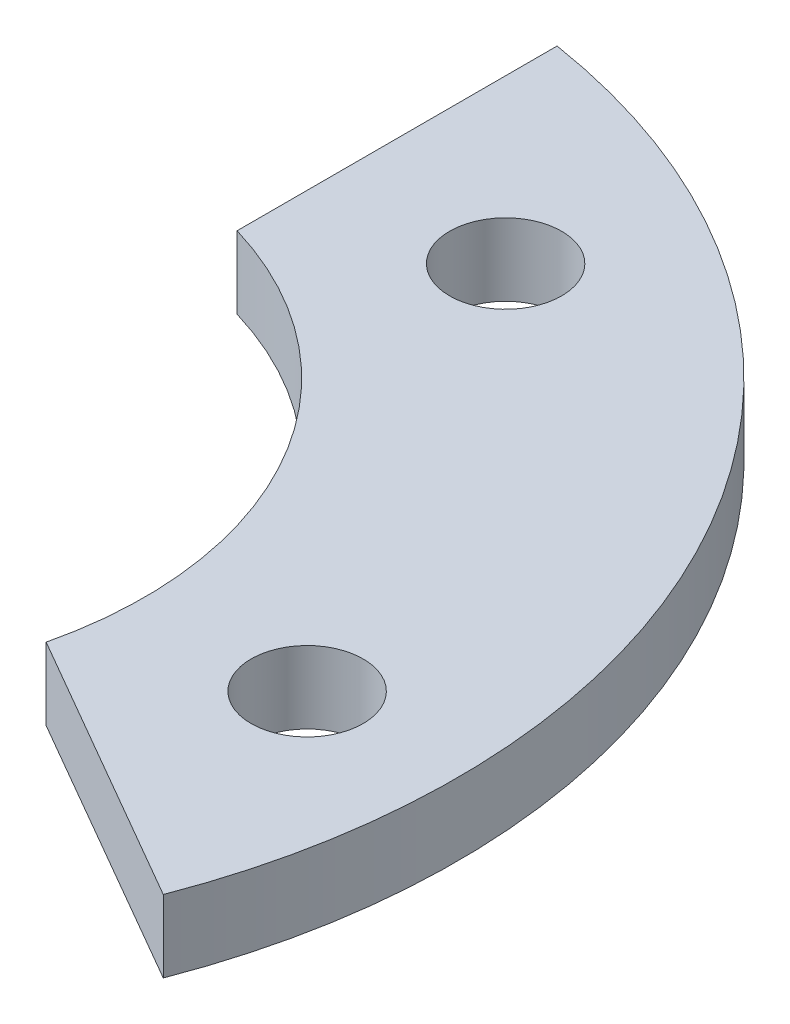
from build123d import *

# Parameters (mm, degrees)
SKETCH1_R           = 38.3
SKETCH1_R_2         = 3.1
SKETCH1_R_3         = 21
BOSS_EXTRUDE1_DEPTH = 4
CUT_EXTRUDE1_DEPTH  = 10


with BuildPart() as part:
    # Sketch1 → Boss-Extrude1 (new body)
    with BuildSketch(Plane(origin=(0, 0, 0), x_dir=(1, 0, 0), z_dir=(0, 1, 0))):
        with Locations(Location((0, 0, 0), (0, 0, 270))):
            Circle(SKETCH1_R)
        with Locations(Location((30, 0, 0), (0, 0, 270))):
            Circle(SKETCH1_R_2, mode=Mode.SUBTRACT)
        with Locations(Location((0, 0, 0), (0, 0, 270))):
            Circle(SKETCH1_R_3, mode=Mode.SUBTRACT)
        with Locations(Location((15, -25.980762114, 0), (0, 0, 270))):
            Circle(SKETCH1_R_2, mode=Mode.SUBTRACT)
        with Locations(Location((-15, -25.980762114, 0), (0, 0, 270))):
            Circle(SKETCH1_R_2, mode=Mode.SUBTRACT)
        with Locations(Location((-30, 0, 0), (0, 0, 270))):
            Circle(SKETCH1_R_2, mode=Mode.SUBTRACT)
        with Locations(Location((-15, 25.980762114, 0), (0, 0, 270))):
            Circle(SKETCH1_R_2, mode=Mode.SUBTRACT)
        with Locations(Location((15, 25.980762114, 0), (0, 0, 270))):
            Circle(SKETCH1_R_2, mode=Mode.SUBTRACT)
    extrude(amount=BOSS_EXTRUDE1_DEPTH)

    # Sketch2 → Cut-Extrude1 (cut)
    with BuildSketch(Plane(origin=(0, 4, 0), x_dir=(1, 0, 0), z_dir=(0, 1, 0))):
        with BuildLine():
            Line((6, 50.276302336), (6, 14.297506921))
            ThreePointArc((6, 14.297506921), (13.428105902, 7.752720557), (15.382004204, -1.952601038))
            Line((15.382004204, -1.952601038), (46.540555031, -19.941998745))
            ThreePointArc((46.540555031, -19.941998745), (-43.84951462, -25.31652907), (6, 50.276302336))
        make_face()
    extrude(amount=-CUT_EXTRUDE1_DEPTH, mode=Mode.SUBTRACT)


solid = part.part
